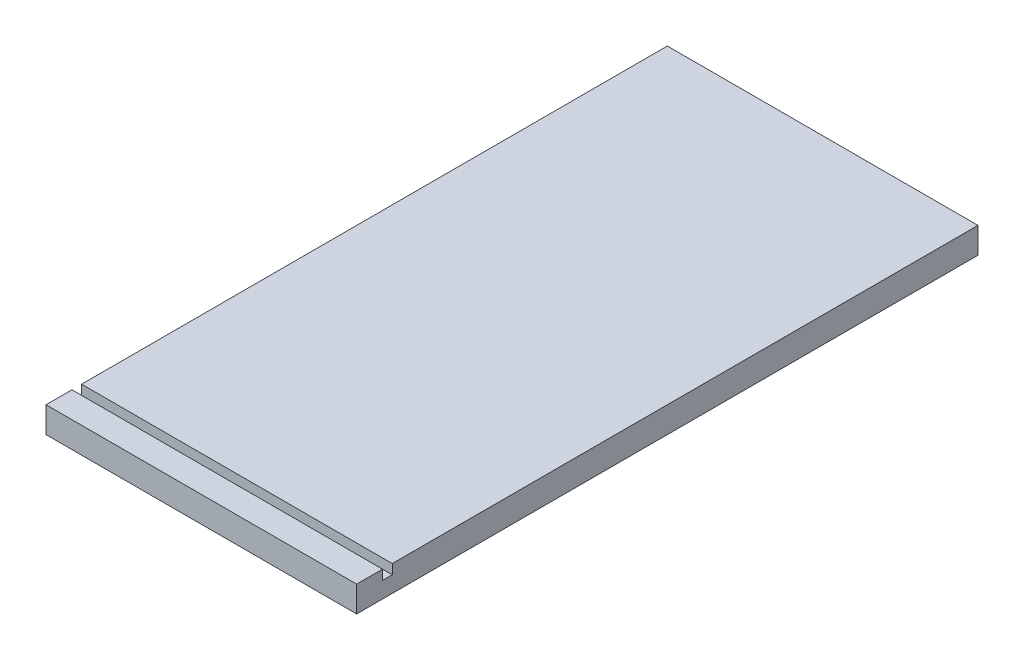
from build123d import *

# Parameters (mm, degrees)
SKETCH2_W           = 304.8
SKETCH2_H           = 609.6
BOSS_EXTRUDE1_DEPTH = 12.7
SKETCH4_W           = 9.525
SKETCH4_H           = 9.525
CUT_EXTRUDE1_DEPTH  = 432.239341897


with BuildPart() as part:
    # Sketch2 → Boss-Extrude1 (new, symmetric)
    with BuildSketch(Plane(origin=(0, 0, 0), x_dir=(1, 0, 0), z_dir=(0, 1, 0))):
        Rectangle(SKETCH2_W, SKETCH2_H)
    extrude(amount=BOSS_EXTRUDE1_DEPTH, both=True)

    # Sketch4 → Cut-Extrude1 (cut, through all)
    with BuildSketch(Plane.ZY.offset(152.4)):
        with Locations((274.6375, 7.9375)):
            Rectangle(SKETCH4_W, SKETCH4_H)
    extrude(amount=-CUT_EXTRUDE1_DEPTH, mode=Mode.SUBTRACT)


solid = part.part
